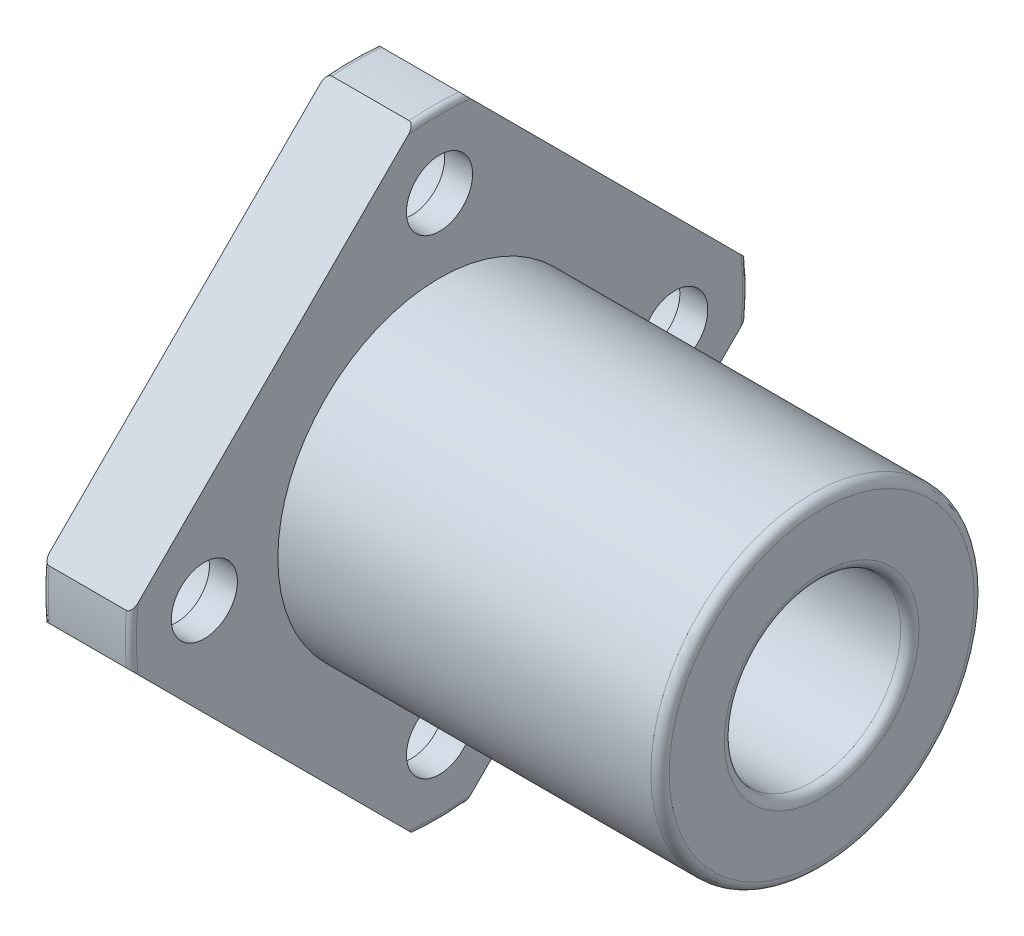
from build123d import *

# Parameters (mm, degrees)
BOSS_EXTRUDE1_DEPTH                              = 6
SKETCH2_W                                        = 26
SKETCH2_H                                        = 11
CBORE_FOR_M4_HEX_HEAD_MACHINE_SCREW1_D           = 4.5
CBORE_FOR_M4_HEX_HEAD_MACHINE_SCREW1_DEPTH       = 32
CBORE_FOR_M4_HEX_HEAD_MACHINE_SCREW1_CBORE_D     = 7.5
CBORE_FOR_M4_HEX_HEAD_MACHINE_SCREW1_CBORE_DEPTH = 4.1
F_12_0_12_DIAMETER_HOLE1_D                       = 12
FILLET1_R                                        = 0.375
FILLET2_R                                        = 0.625


with BuildPart() as part:
    # Sketch1 → Boss-Extrude1 (new body)
    with BuildSketch(Plane(origin=(0, 0, 0), x_dir=(0, -1, 0), z_dir=(-1, 0, 0))):
        with BuildLine():
            Line((-1.696016468, 20.93140053), (-20.93140053, 1.696016468))
            ThreePointArc((-20.93140053, 1.696016468), (-21, 0), (-20.93140053, -1.696016468))
            Line((-20.93140053, -1.696016468), (-1.696016468, -20.93140053))
            ThreePointArc((-1.696016468, -20.93140053), (0, -21), (1.696016468, -20.93140053))
            Line((1.696016468, -20.93140053), (20.93140053, -1.696016468))
            ThreePointArc((20.93140053, -1.696016468), (21, 0), (20.93140053, 1.696016468))
            Line((20.93140053, 1.696016468), (1.696016468, 20.93140053))
            ThreePointArc((1.696016468, 20.93140053), (0, 21), (-1.696016468, 20.93140053))
        make_face()
    extrude(amount=-BOSS_EXTRUDE1_DEPTH)

    # Sketch2 → Revolve1 (revolve)
    with BuildSketch(Plane.XY, mode=Mode.PRIVATE) as revolve1_sk:
        with Locations((19, 5.5)):
            Rectangle(SKETCH2_W, SKETCH2_H)
    revolve(revolve1_sk.sketch.rotate(Axis((6, 0, 0), (1, 0, 0)), 270), axis=Axis((6, 0, 0), (1, 0, 0)))

    # CBORE for M4 Hex Head Machine Screw1
    with Locations(Plane.ZY):
        with Locations((0, 16), (0, -16), (-16, 0), (16, 0)):
            CounterBoreHole(CBORE_FOR_M4_HEX_HEAD_MACHINE_SCREW1_D / 2, CBORE_FOR_M4_HEX_HEAD_MACHINE_SCREW1_CBORE_D / 2, CBORE_FOR_M4_HEX_HEAD_MACHINE_SCREW1_CBORE_DEPTH, depth=CBORE_FOR_M4_HEX_HEAD_MACHINE_SCREW1_DEPTH)

    # Ø12.0 (12) Diameter Hole1 (through all)
    with Locations(Plane.ZY):
        with Locations((0, 0)):
            Hole(F_12_0_12_DIAMETER_HOLE1_D / 2)

    # Fillet1
    fillet1_edges = [part.edges().sort_by_distance(p)[0] for p in [
        (0, 21, 0),
        (0, 0, 21),
        (6, 21, 0),
        (6, 0, -21),
        (6, -21, 0),
        (6, 0, 21),
        (0, -21, 0),
        (0, 0, -21),
    ]]
    fillet(fillet1_edges, radius=FILLET1_R)

    # Fillet2
    fillet2_edges = [part.edges().sort_by_distance(p)[0] for p in [
        (32, 0, 11),
        (0, 0, 6),
        (32, 0, 6),
    ]]
    fillet(fillet2_edges, radius=FILLET2_R)


solid = part.part
